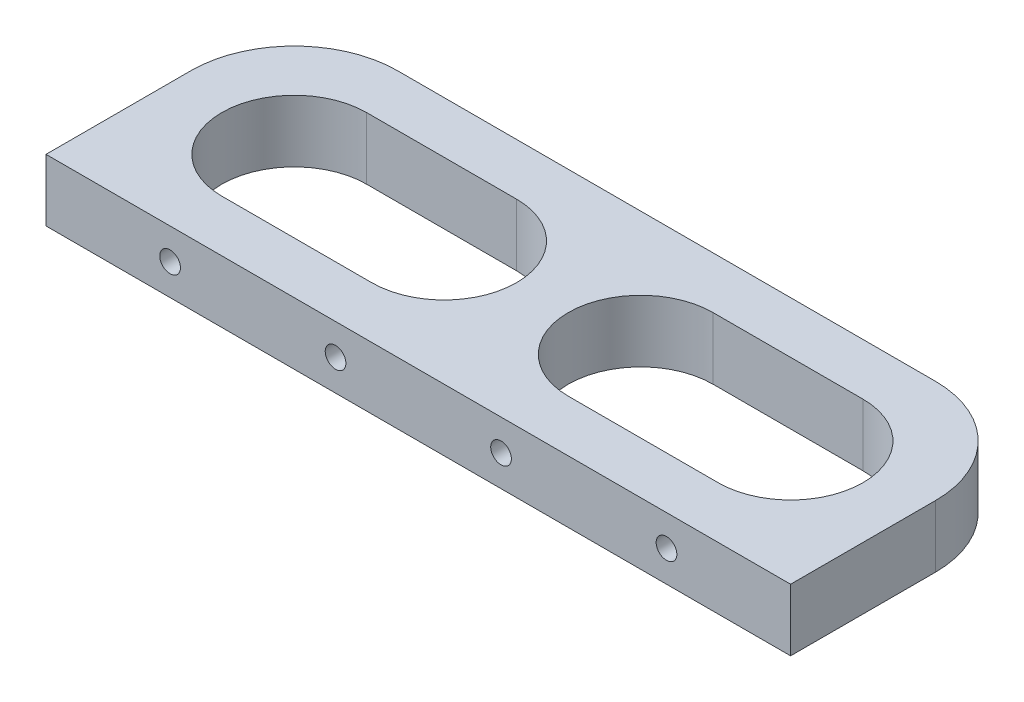
from build123d import *

# Parameters (mm, degrees)
SKETCH1_W                       = 180
SKETCH1_H                       = 60
BOSS_EXTRUDE1_DEPTH             = 15
CUT_EXTRUDE1_DEPTH              = 97.046863561
TAP_DRILL_FOR_M6X1_0_TAP1_D     = 5
TAP_DRILL_FOR_M6X1_0_TAP1_DEPTH = 9
TAP_DRILL_FOR_M6X1_0_TAP1_TIP   = 1.502151548
FILLET1_R                       = 25
TAP_DRILL_FOR_M6X1_0_TAP2_D     = 5
TAP_DRILL_FOR_M6X1_0_TAP2_DEPTH = 9
TAP_DRILL_FOR_M6X1_0_TAP2_TIP   = 1.502151548


with BuildPart() as part:
    # Sketch1 → Boss-Extrude1 (new body)
    with BuildSketch(Plane(origin=(0, 0, 0), x_dir=(1, 0, 0), z_dir=(0, 1, 0))):
        Rectangle(SKETCH1_W, SKETCH1_H)
    extrude(amount=BOSS_EXTRUDE1_DEPTH)

    # Sketch2 → Cut-Extrude1 (cut, through all)
    with BuildSketch(Plane(origin=(0, 15, 0), x_dir=(1, 0, 0), z_dir=(0, 1, 0))):
        with BuildLine():
            Line((-60, 17.5), (-23.75, 17.5))
            ThreePointArc((-23.75, 17.5), (-6.25, 0), (-23.75, -17.5))
            Line((-23.75, -17.5), (-60, -17.5))
            ThreePointArc((-60, -17.5), (-77.5, 0), (-60, 17.5))
        make_face()
        with BuildLine():
            Line((23.75, 17.5), (60, 17.5))
            ThreePointArc((60, 17.5), (77.5, 0), (60, -17.5))
            Line((60, -17.5), (23.75, -17.5))
            ThreePointArc((23.75, -17.5), (6.25, 0), (23.75, 17.5))
        make_face()
    extrude(amount=-CUT_EXTRUDE1_DEPTH, mode=Mode.SUBTRACT)

    # Tap Drill for M6x1.0 Tap1
    with Locations(Plane.XY.offset(30)):
        with Locations((60, 7.5), (-20, 7.5), (20, 7.5), (-60, 7.5)):
            Hole(TAP_DRILL_FOR_M6X1_0_TAP1_D / 2, depth=TAP_DRILL_FOR_M6X1_0_TAP1_DEPTH)
            with Locations((0, 0, -(TAP_DRILL_FOR_M6X1_0_TAP1_DEPTH + TAP_DRILL_FOR_M6X1_0_TAP1_TIP / 2))):  # 118° drill point
                Cone(0, TAP_DRILL_FOR_M6X1_0_TAP1_D / 2, TAP_DRILL_FOR_M6X1_0_TAP1_TIP, mode=Mode.SUBTRACT)

    # Fillet1
    fillet1_edges = [part.edges().sort_by_distance(p)[0] for p in [
        (-90, 7.5, -30),
        (90, 7.5, -30),
    ]]
    fillet(fillet1_edges, radius=FILLET1_R)

    # Tap Drill for M6x1.0 Tap2
    with Locations(Plane(origin=(0, 0, -30), x_dir=(-1, 0, 0), z_dir=(0, 0, -1))):
        with Locations((-45, 7.5), (-15, 7.5), (15, 7.5), (45, 7.5)):
            Hole(TAP_DRILL_FOR_M6X1_0_TAP2_D / 2, depth=TAP_DRILL_FOR_M6X1_0_TAP2_DEPTH)
            with Locations((0, 0, -(TAP_DRILL_FOR_M6X1_0_TAP2_DEPTH + TAP_DRILL_FOR_M6X1_0_TAP2_TIP / 2))):  # 118° drill point
                Cone(0, TAP_DRILL_FOR_M6X1_0_TAP2_D / 2, TAP_DRILL_FOR_M6X1_0_TAP2_TIP, mode=Mode.SUBTRACT)


solid = part.part
